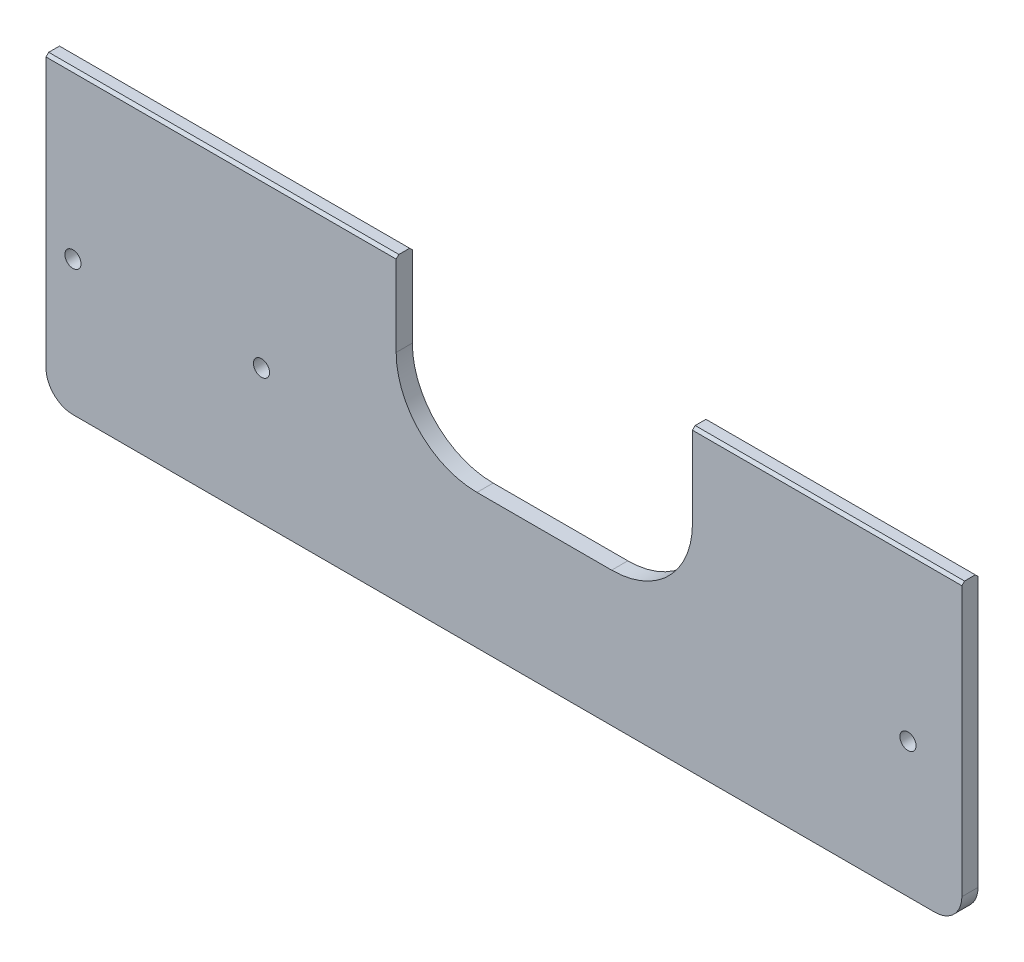
from build123d import *

# Parameters (mm, degrees)
SKETCH_1_W          = 170
SKETCH_1_H          = 55.5
EXTRUDE_1_DEPTH     = 3
SKETCH_2_R          = 1.5
CUT_EXTRUDE_1_DEPTH = 3
CUT_EXTRUDE_2_DEPTH = 3
FILLET_1_R          = 5
SKETCH_4_R          = 1.5
CUT_EXTRUDE_3_DEPTH = 3
CHAMFER_1_SIZE      = 0.5


with BuildPart() as part:
    # 草图1 → 凸台-拉伸1 (new body)
    with BuildSketch(Plane.XY):
        with Locations((-15, -12.75)):
            Rectangle(SKETCH_1_W, SKETCH_1_H)
    extrude(amount=EXTRUDE_1_DEPTH)

    # 草图2 → 切除-拉伸1 (cut)
    with BuildSketch(Plane.XY.offset(3)):
        with Locations((60, -15.5)):
            Circle(SKETCH_2_R)
        with Locations((-60, -15.5)):
            Circle(SKETCH_2_R)
    extrude(amount=-CUT_EXTRUDE_1_DEPTH, mode=Mode.SUBTRACT)

    # 草图3 → 切除-拉伸2 (cut)
    with BuildSketch(Plane.XY.offset(3)):
        with BuildLine():
            Line((-20, -15.5), (5, -15.5))
            ThreePointArc((5, -15.5), (15.606601718, -11.106601718), (20, -0.5))
            Line((20, -0.5), (20, 15))
            Line((20, 15), (-35, 15))
            Line((-35, 15), (-35, -0.5))
            ThreePointArc((-35, -0.5), (-30.606601718, -11.106601718), (-20, -15.5))
        make_face()
    extrude(amount=-CUT_EXTRUDE_2_DEPTH, mode=Mode.SUBTRACT)

    # 圆角1
    fillet_1_edges = [part.edges().sort_by_distance(p)[0] for p in [
        (70, -40.5, 1.5),
        (-100, -40.5, 1.5),
    ]]
    fillet(fillet_1_edges, radius=FILLET_1_R)

    # 草图4 → 切除-拉伸3 (cut)
    with BuildSketch(Plane.XY.offset(3)):
        with Locations((-95, -15.5)):
            Circle(SKETCH_4_R)
    extrude(amount=-CUT_EXTRUDE_3_DEPTH, mode=Mode.SUBTRACT)

    # 倒角1
    chamfer_1_edges = [part.edges().sort_by_distance(p)[0] for p in [
        (45, 15, 3),
        (-67.5, 15, 0),
        (-67.5, 15, 3),
        (45, 15, 0),
    ]]
    chamfer(chamfer_1_edges, length=CHAMFER_1_SIZE)


solid = part.part
